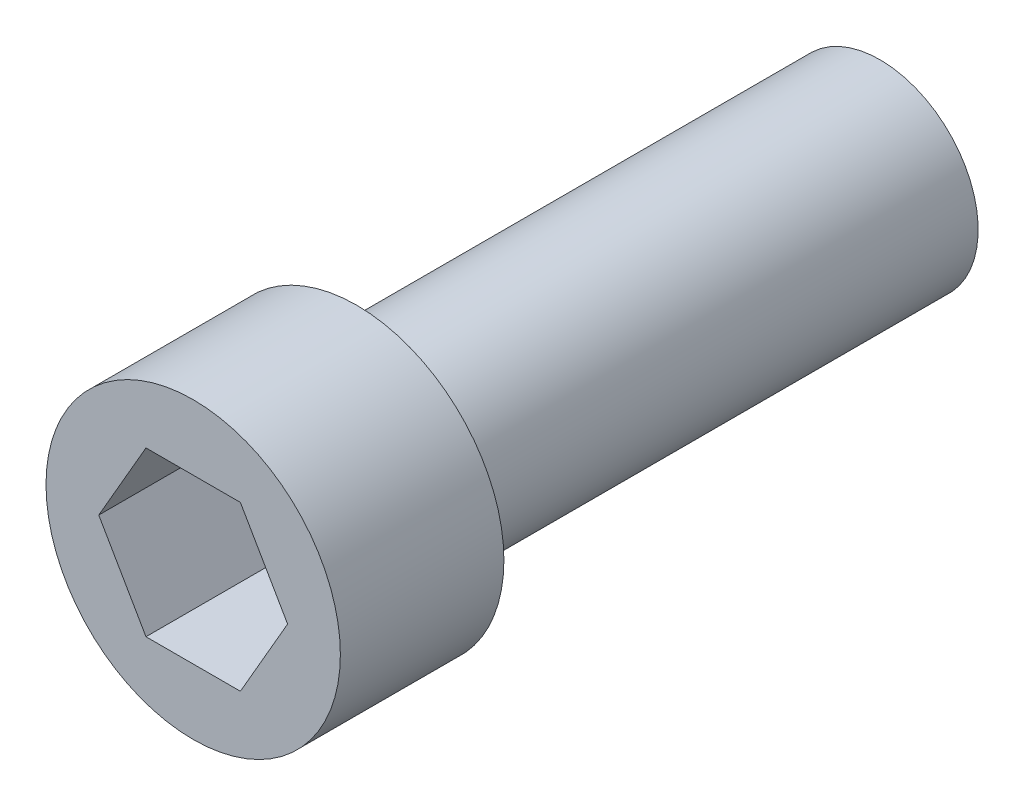
from build123d import *

# Parameters (mm, degrees)
SKETCH1_R           = 2.25
BOSS_EXTRUDE1_DEPTH = 2.5
CUT_EXTRUDE1_DEPTH  = 2
SKETCH3_R           = 1.5
BOSS_EXTRUDE2_DEPTH = 8


with BuildPart() as part:
    # Sketch1 → Boss-Extrude1 (new body)
    with BuildSketch(Plane.XY):
        Circle(SKETCH1_R)
    extrude(amount=BOSS_EXTRUDE1_DEPTH)

    # Sketch2 → Cut-Extrude1 (cut)
    with BuildSketch(Plane.XY.offset(2.5)):
        Polygon((1.443375673, 0), (0.721687836, 1.25), (-0.721687836, 1.25), (-1.443375673, 0), (-0.721687836, -1.25), (0.721687836, -1.25), align=None)
    extrude(amount=-CUT_EXTRUDE1_DEPTH, mode=Mode.SUBTRACT)

    # Sketch3 → Boss-Extrude2 (add)
    with BuildSketch(Plane(origin=(0, 0, 0), x_dir=(-1, 0, 0), z_dir=(0, 0, -1))):
        Circle(SKETCH3_R)
    extrude(amount=BOSS_EXTRUDE2_DEPTH)


solid = part.part
